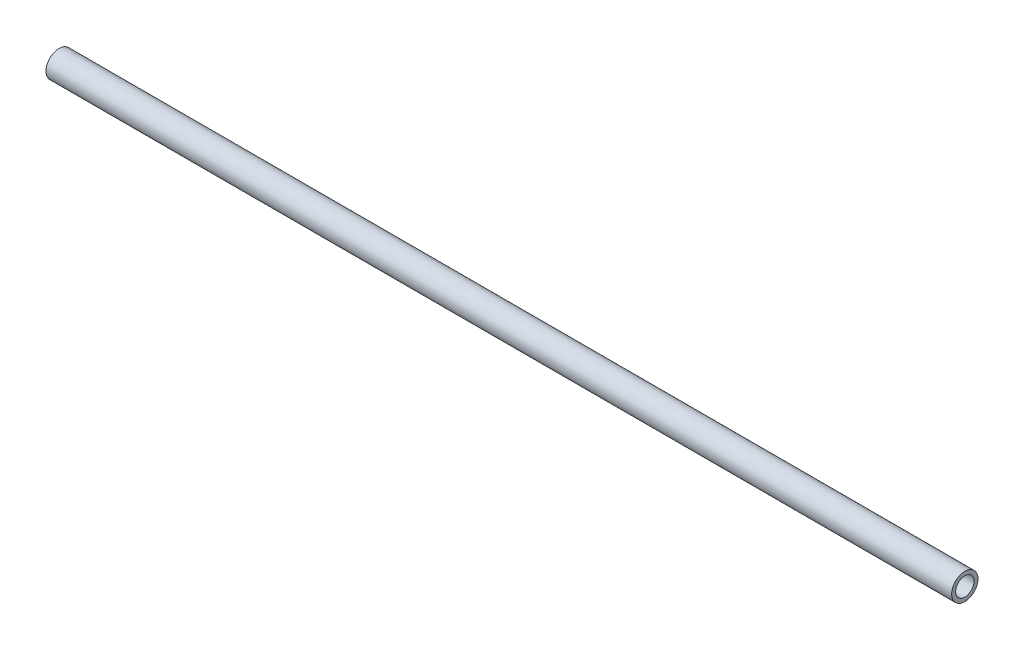
from build123d import *

# Parameters (mm, degrees)
SKETCH1_R           = 15.875
SKETCH1_R_2         = 11.1125
BOSS_EXTRUDE1_DEPTH = 1092.2


with BuildPart() as part:
    # Sketch1 → Boss-Extrude1 (new body)
    with BuildSketch(Plane(origin=(0, 0, 0), x_dir=(0, 0, -1), z_dir=(1, 0, 0))):
        Circle(SKETCH1_R)
        Circle(SKETCH1_R_2, mode=Mode.SUBTRACT)
    extrude(amount=BOSS_EXTRUDE1_DEPTH)


solid = part.part
